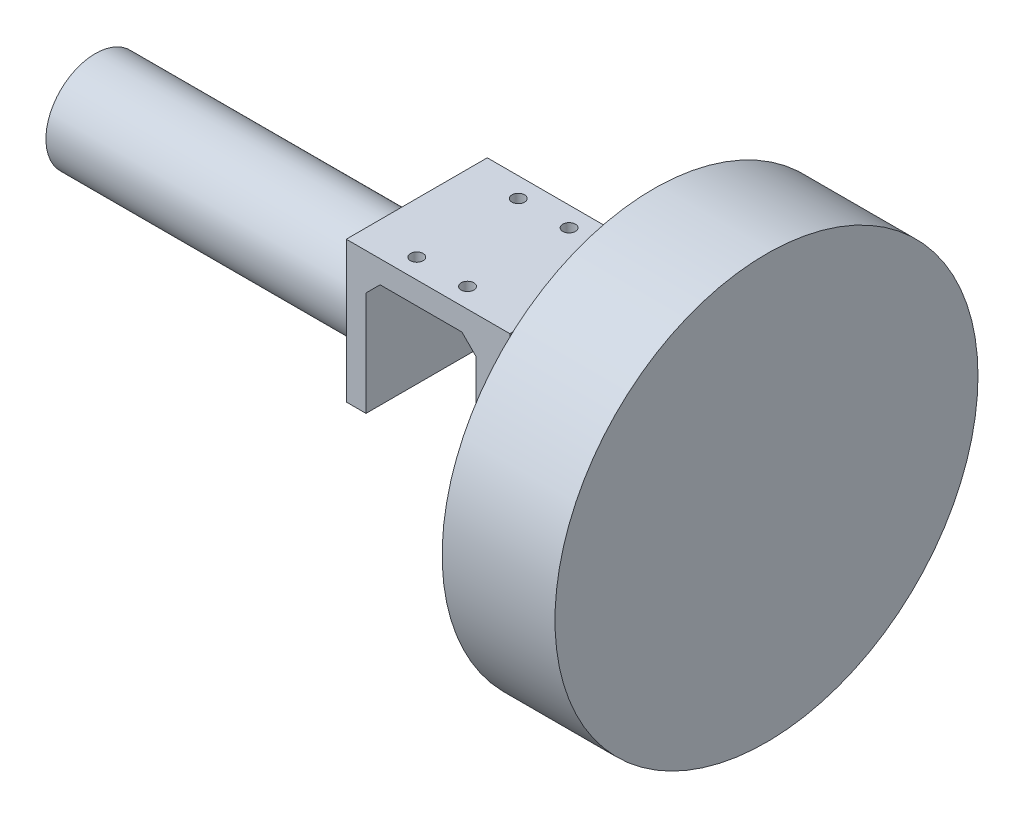
from build123d import *

# Parameters (mm, degrees)
SZKIC1_R                    = 75
DODANIE_WYCI_GNI_CIE1_DEPTH = 20
SZKIC2_R                    = 14
DODANIE_WYCI_GNI_CIE2_DEPTH = 20
SZKIC3_R                    = 7
DODANIE_WYCI_GNI_CIE3_DEPTH = 6
DODANIE_WYCI_GNI_CIE4_DEPTH = 25
SFAZOWANIE1_SIZE            = 5
SZKIC5_R                    = 17.5
DODANIE_WYCI_GNI_CIE5_DEPTH = 114
OTW_R_POD_RUB_M41_D         = 4.5


with BuildPart() as part:
    # Szkic1 → Dodanie-wyciągnięcie1 (new, symmetric)
    with BuildSketch(Plane(origin=(0, 0, 0), x_dir=(0, 0, -1), z_dir=(1, 0, 0))):
        Circle(SZKIC1_R)
    extrude(amount=DODANIE_WYCI_GNI_CIE1_DEPTH, both=True)

    # Szkic2 → Dodanie-wyciągnięcie2 (add)
    with BuildSketch(Plane.ZY.offset(20)):
        Circle(SZKIC2_R)
    extrude(amount=DODANIE_WYCI_GNI_CIE2_DEPTH)

    # Szkic3 → Dodanie-wyciągnięcie3 (add)
    with BuildSketch(Plane.ZY.offset(40)):
        Circle(SZKIC3_R)
    extrude(amount=DODANIE_WYCI_GNI_CIE3_DEPTH)

    # Szkic4 → Dodanie-wyciągnięcie4 (add, symmetric)
    with BuildSketch(Plane.XY):
        Polygon((-46, -20), (-46, 30), (-104, 30), (-104, -20), (-97, -20), (-97, 22), (-58, 22), (-58, -20), align=None)
    extrude(amount=DODANIE_WYCI_GNI_CIE4_DEPTH, both=True)

    # Sfazowanie1
    sfazowanie1_edges = [part.edges().sort_by_distance(p)[0] for p in [
        (-97, 22, 0),
        (-58, 22, 0),
    ]]
    chamfer(sfazowanie1_edges, length=SFAZOWANIE1_SIZE)

    # Szkic5 → Dodanie-wyciągnięcie5 (add)
    with BuildSketch(Plane.ZY.offset(104)):
        with Locations(Location((0, 0, 0), (0, 0, 180))):
            Circle(SZKIC5_R)
    extrude(amount=DODANIE_WYCI_GNI_CIE5_DEPTH)

    # Otwór pod śrubę M41 (through all)
    with Locations(Plane(origin=(0, 30, 0), x_dir=(1, 0, 0), z_dir=(0, 1, 0))):
        with Locations((-68, 18), (-86, 18), (-68, -18), (-86, -18)):
            Hole(OTW_R_POD_RUB_M41_D / 2)


solid = part.part
